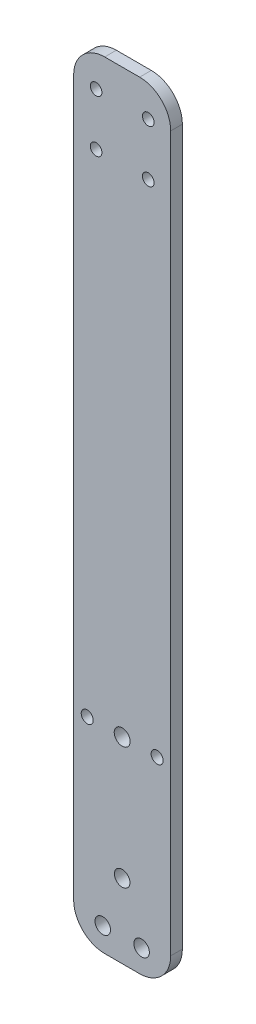
from build123d import *

# Parameters (mm, degrees)
SKETCH_1_W          = 25
SKETCH_1_H          = 200
SKETCH_1_R          = 2
SKETCH_1_R_2        = 1.5
SKETCH_1_R_3        = 2.05
EXTRUDE_1_DEPTH     = 3
FILLET_1_R          = 8
CUT_EXTRUDE_1_REACH = 203.579
SKETCH_3_R          = 1.55


with BuildPart() as part:
    # 草图1 → 凸台-拉伸1 (new body)
    with BuildSketch(Plane.XY):
        with Locations((12.5, 100)):
            Rectangle(SKETCH_1_W, SKETCH_1_H)
        with Locations((7.5, 6)):
            Circle(SKETCH_1_R, mode=Mode.SUBTRACT)
        with Locations(Location((17.5, 6, 0), (0, 0, 180))):
            Circle(SKETCH_1_R, mode=Mode.SUBTRACT)
        with Locations((12.5, 19.055282456)):
            Circle(SKETCH_1_R, mode=Mode.SUBTRACT)
        with Locations((5.782485579, 178.282485579)):
            Circle(SKETCH_1_R_2, mode=Mode.SUBTRACT)
        with Locations((5.782485579, 191.717514421)):
            Circle(SKETCH_1_R_2, mode=Mode.SUBTRACT)
        with Locations((19.217514421, 191.717514421)):
            Circle(SKETCH_1_R_2, mode=Mode.SUBTRACT)
        with Locations((19.217514421, 178.282485579)):
            Circle(SKETCH_1_R_2, mode=Mode.SUBTRACT)
        with Locations((12.5, 50.562827646)):
            Circle(SKETCH_1_R_3, mode=Mode.SUBTRACT)
    extrude(amount=EXTRUDE_1_DEPTH)

    # 圆角1
    fillet_1_edges = [part.edges().sort_by_distance(p)[0] for p in [
        (0, 200, 1.5),
        (25, 200, 1.5),
        (25, 0, 1.5),
        (0, 0, 1.5),
    ]]
    fillet(fillet_1_edges, radius=FILLET_1_R)

    # 草图3 → 切除-拉伸1 (cut, up to next)
    with BuildSketch(Plane.XY.offset(3), mode=Mode.PRIVATE) as cut_extrude_1_sk1:
        with Locations((21.5, 50.562827646)):
            Circle(SKETCH_3_R)
    cut_extrude_1_tool1 = extrude(cut_extrude_1_sk1.sketch, amount=-CUT_EXTRUDE_1_REACH, mode=Mode.PRIVATE) & part.part
    # 草图3 → 切除-拉伸1 (cut, up to next)
    with BuildSketch(Plane.XY.offset(3), mode=Mode.PRIVATE) as cut_extrude_1_sk2:
        with Locations((3.5, 50.562827646)):
            Circle(SKETCH_3_R)
    cut_extrude_1_tool2 = extrude(cut_extrude_1_sk2.sketch, amount=-CUT_EXTRUDE_1_REACH, mode=Mode.PRIVATE) & part.part
    add(cut_extrude_1_tool1.solids().sort_by_distance((21.5, 50.562828, 3))[0], mode=Mode.SUBTRACT)
    add(cut_extrude_1_tool2.solids().sort_by_distance((3.5, 50.562828, 3))[0], mode=Mode.SUBTRACT)


solid = part.part
